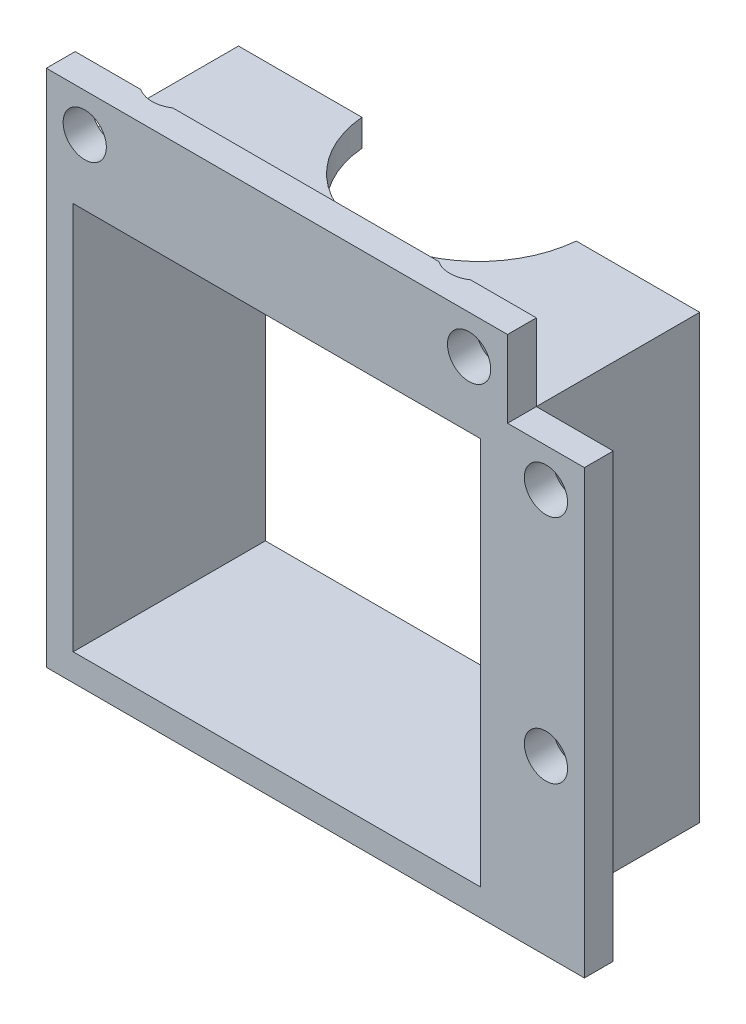
from build123d import *

# Parameters (mm, degrees)
SKETCH1_W           = 48
SKETCH1_H           = 46
SKETCH1_W_2         = 42.4
SKETCH1_H_2         = 40.4
BOSS_EXTRUDE1_DEPTH = 20
CUT_EXTRUDE1_REACH  = 59.498
SKETCH3_R           = 11.2
CUT_EXTRUDE2_REACH  = 59.498
SKETCH5_R           = 1.7
SKETCH6_W           = 8
SKETCH6_H           = 46
SKETCH6_R           = 2.25
SKETCH6_W_2         = 48
SKETCH6_H_2         = 8
BOSS_EXTRUDE2_DEPTH = 3
SKETCH7_R           = 3
CUT_EXTRUDE3_DEPTH  = 8


with BuildPart() as part:
    # Sketch1 → Boss-Extrude1 (new body)
    with BuildSketch(Plane.XY):
        with Locations((-4.106729999, -49.5)):
            Rectangle(SKETCH1_W, SKETCH1_H)
        with Locations((-4.106729999, -49.5)):
            Rectangle(SKETCH1_W_2, SKETCH1_H_2, mode=Mode.SUBTRACT)
    extrude(amount=-BOSS_EXTRUDE1_DEPTH)

    # Sketch3 → Cut-Extrude1 (cut, up to next)
    with BuildSketch(Plane(origin=(0, -26.5, 0), x_dir=(1, 0, 0), z_dir=(0, 1, 0)), mode=Mode.PRIVATE) as cut_extrude1_sk1:
        with Locations((-4.106729999, 21)):
            Circle(SKETCH3_R)
    cut_extrude1_tool1 = extrude(cut_extrude1_sk1.sketch, amount=-CUT_EXTRUDE1_REACH, mode=Mode.PRIVATE) & part.part
    add(cut_extrude1_tool1.solids().sort_by_distance((-4.10673, -26.5, -21))[0], mode=Mode.SUBTRACT)

    # Sketch5 → Cut-Extrude2 (cut, up to next)
    with BuildSketch(Plane(origin=(0, -26.5, 0), x_dir=(1, 0, 0), z_dir=(0, 1, 0)), mode=Mode.PRIVATE) as cut_extrude2_sk1:
        with Locations(Location((11.393270001, 5.5, 0), (0, 0, 270))):
            Circle(SKETCH5_R)
    cut_extrude2_tool1 = extrude(cut_extrude2_sk1.sketch, amount=-CUT_EXTRUDE2_REACH, mode=Mode.PRIVATE) & part.part
    # Sketch5 → Cut-Extrude2 (cut, up to next)
    with BuildSketch(Plane(origin=(0, -26.5, 0), x_dir=(1, 0, 0), z_dir=(0, 1, 0)), mode=Mode.PRIVATE) as cut_extrude2_sk2:
        with Locations(Location((-19.606729999, 5.5, 0), (0, 0, 270))):
            Circle(SKETCH5_R)
    cut_extrude2_tool2 = extrude(cut_extrude2_sk2.sketch, amount=-CUT_EXTRUDE2_REACH, mode=Mode.PRIVATE) & part.part
    add(cut_extrude2_tool1.solids().sort_by_distance((11.39327, -26.5, -5.5))[0], mode=Mode.SUBTRACT)
    add(cut_extrude2_tool2.solids().sort_by_distance((-19.60673, -26.5, -5.5))[0], mode=Mode.SUBTRACT)

    # Sketch6 → Boss-Extrude2 (add)
    # profile 1 of 2: a face of its own
    with BuildSketch(Plane.XY):
        with Locations((23.893270001, -49.5)):
            Rectangle(SKETCH6_W, SKETCH6_H)
        with Locations((23.893270001, -54.5)):
            Circle(SKETCH6_R, mode=Mode.SUBTRACT)
        with Locations((23.893270001, -30.5)):
            Circle(SKETCH6_R, mode=Mode.SUBTRACT)
    # profile 2 of 2: a face of its own
    with BuildSketch(Plane.XY):
        with Locations((-4.106729999, -22.5)):
            Rectangle(SKETCH6_W_2, SKETCH6_H_2)
        with Locations((-24.106729999, -22.5)):
            Circle(SKETCH6_R, mode=Mode.SUBTRACT)
        with Locations((15.893270001, -22.5)):
            Circle(SKETCH6_R, mode=Mode.SUBTRACT)
    extrude(amount=-BOSS_EXTRUDE2_DEPTH)

    # Sketch7 → Cut-Extrude3 (cut)
    with BuildSketch(Plane(origin=(0, -18.5, 0), x_dir=(1, 0, 0), z_dir=(0, 1, 0))):
        with Locations((11.393270001, 5.5)):
            Circle(SKETCH7_R)
        with Locations((-19.606729999, 5.5)):
            Circle(SKETCH7_R)
    extrude(amount=-CUT_EXTRUDE3_DEPTH, mode=Mode.SUBTRACT)


solid = part.part
